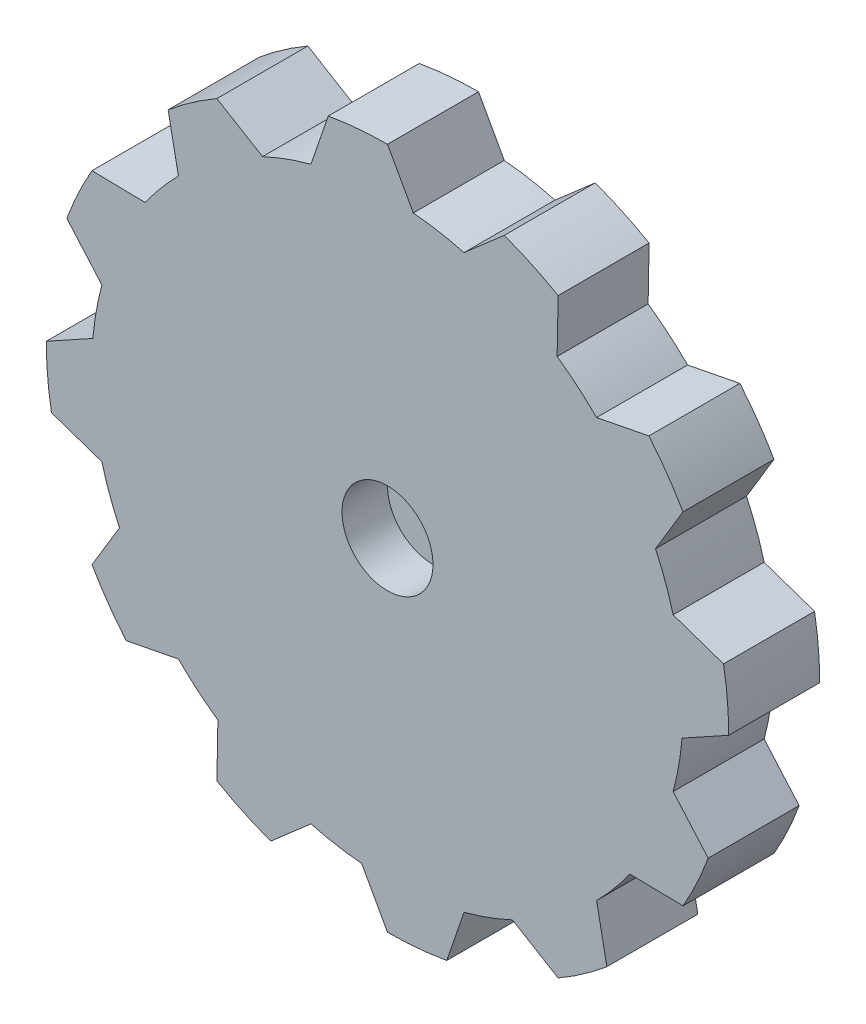
from build123d import *

# Parameters (mm, degrees)
CROQUIS1_R              = 75
SALIENTE_EXTRUIR1_DEPTH = 20
CROQUIS3_R              = 10
CORTAR_EXTRUIR2_DEPTH   = 10
CORTAR_EXTRUIR3_START   = -20
CORTAR_EXTRUIR3_DEPTH   = 20
MATRIZC3_COUNT          = 12


with BuildPart() as part:
    # Croquis1 → Saliente-Extruir1 (new body)
    with BuildSketch(Plane.XY):
        Circle(CROQUIS1_R)
    extrude(amount=SALIENTE_EXTRUIR1_DEPTH)

    # Croquis3 → Cortar-Extruir2 (cut)
    with BuildSketch(Plane.XY.offset(20)):
        Circle(CROQUIS3_R)
    cortar_extruir2 = extrude(amount=-CORTAR_EXTRUIR2_DEPTH, mode=Mode.SUBTRACT)

    # Croquis2 → Cortar-Extruir3 (cut)
    with BuildSketch(Plane.XY.offset(20).offset(CORTAR_EXTRUIR3_START)):
        with BuildLine():
            Line((64.752655376, -5.665123279), (75, 0))
            ThreePointArc((75, 0), (73.860581476, -13.023613325), (70.476946559, -25.651510749))
            Line((70.476946559, -25.651510749), (62.785178709, -16.823237932))
            ThreePointArc((62.785178709, -16.823237932), (64.012503946, -11.287131548), (64.752655376, -5.665123279))
        make_face()
    cortar_extruir3 = extrude(amount=CORTAR_EXTRUIR3_DEPTH, mode=Mode.SUBTRACT)

    # MatrizC3: Cortar-Extruir2, Cortar-Extruir3 ×12 about axis
    matrizc3_axis = Axis((0, 0, 0), (0, 0, 1))
    add([cortar_extruir2.rotate(matrizc3_axis, i * 360 / MATRIZC3_COUNT) for i in range(1, MATRIZC3_COUNT)], mode=Mode.SUBTRACT)
    add([cortar_extruir3.rotate(matrizc3_axis, i * 360 / MATRIZC3_COUNT) for i in range(1, MATRIZC3_COUNT)], mode=Mode.SUBTRACT)


solid = part.part
